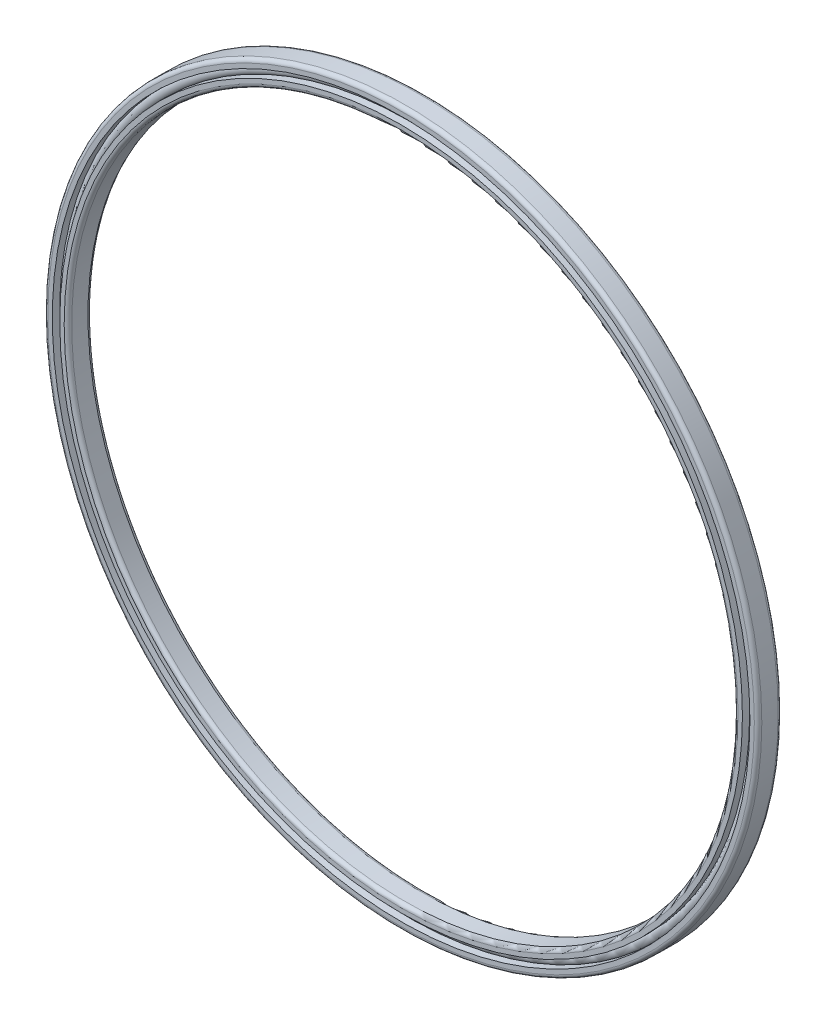
from build123d import *

# Parameters (mm, degrees)
SKETCH_1_R = 1.5875


with BuildPart() as part:
    # 草图1 → 旋转1 (revolve)
    with BuildSketch(Plane(origin=(0, 0, 0), x_dir=(1, 0, 0), z_dir=(0, 1, 0))):
        with BuildLine():
            Line((88.9, 5.35), (88.9, 1))
            ThreePointArc((88.9, 1), (89.192893219, 0.292893219), (89.9, 0))
            Line((89.9, 0), (91.075, 0))
            Line((91.075, 0), (91.075, 1.942053833))
            ThreePointArc((91.075, 1.942053833), (90.4875, 3.175), (91.075, 4.407946167))
            Line((91.075, 4.407946167), (91.075, 6.35))
            Line((91.075, 6.35), (89.9, 6.35))
            ThreePointArc((89.9, 6.35), (89.192893219, 6.057106781), (88.9, 5.35))
        make_face()
        with BuildLine():
            ThreePointArc((93.6625, 3.175), (93.508118322, 2.492117781), (93.075, 1.942053833))
            Line((93.075, 1.942053833), (93.075, 0))
            Line((93.075, 0), (94.25, 0))
            ThreePointArc((94.25, 0), (94.957106781, 0.292893219), (95.25, 1))
            Line((95.25, 1), (95.25, 5.35))
            ThreePointArc((95.25, 5.35), (94.957106781, 6.057106781), (94.25, 6.35))
            Line((94.25, 6.35), (93.075, 6.35))
            Line((93.075, 6.35), (93.075, 4.407946167))
            ThreePointArc((93.075, 4.407946167), (93.508118322, 3.857882219), (93.6625, 3.175))
        make_face()
        with Locations((92.075, 3.175)):
            Circle(SKETCH_1_R)
    revolve(axis=Axis((0, 0, 0), (0, 0, -1)))


solid = part.part
